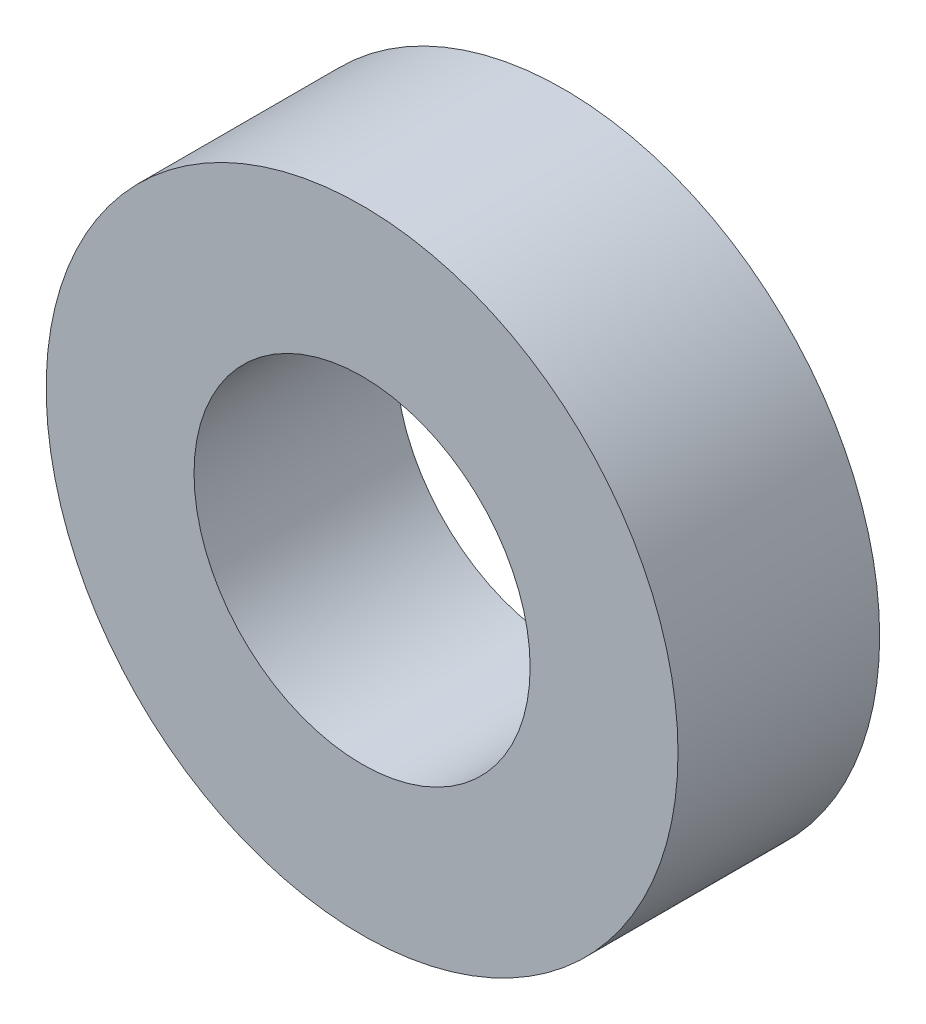
from build123d import *

# Parameters (mm, degrees)
SKETCH1_R           = 23.5
SKETCH1_R_2         = 12.5
BOSS_EXTRUDE1_DEPTH = 15


with BuildPart() as part:
    # Sketch1 → Boss-Extrude1 (new body)
    with BuildSketch(Plane.XY):
        Circle(SKETCH1_R)
        Circle(SKETCH1_R_2, mode=Mode.SUBTRACT)
    extrude(amount=BOSS_EXTRUDE1_DEPTH)


solid = part.part
